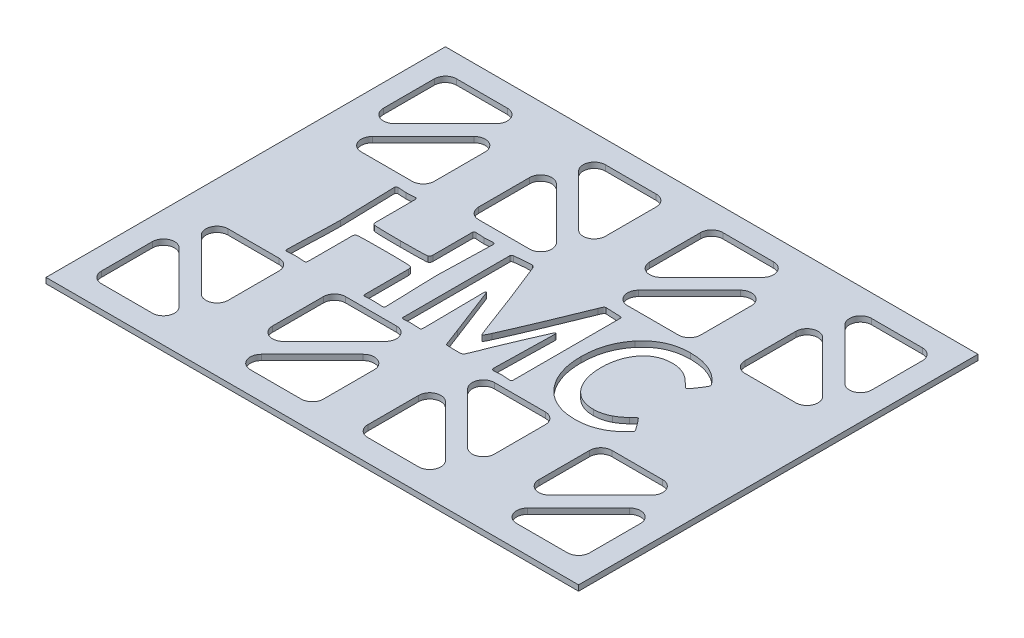
from build123d import *

# Parameters (mm, degrees)
SKETCH2_W           = 609.6
SKETCH2_H           = 457.2
BOSS_EXTRUDE1_DEPTH = 6.35


with BuildPart() as part:
    # Sketch2 → Boss-Extrude1 (new body)
    with BuildSketch(Plane(origin=(0, 0, 0), x_dir=(1, 0, 0), z_dir=(0, 1, 0))):
        with Locations((39.071311338, -112.036262161)):
            Rectangle(SKETCH2_W, SKETCH2_H)
        with BuildLine():
            Line((-240.328688662, 78.463737839), (-240.328688662, 20.224250081))
            ThreePointArc((-240.328688662, 20.224250081), (-232.488768253, 8.490980019), (-218.648432541, 11.24399396))
            Line((-218.648432541, 11.24399396), (-160.408944783, 69.483481718))
            ThreePointArc((-160.408944783, 69.483481718), (-157.655930841, 83.32381743), (-169.389200904, 91.163737839))
            Line((-169.389200904, 91.163737839), (-227.628688662, 91.163737839))
            ThreePointArc((-227.628688662, 91.163737839), (-236.608944783, 87.44399396), (-240.328688662, 78.463737839))
        make_face(mode=Mode.SUBTRACT)
        with BuildLine():
            Line((-218.648432541, -14.15600604), (-160.408944783, 44.083481718))
            ThreePointArc((-160.408944783, 44.083481718), (-146.568609071, 46.83649566), (-138.728688662, 35.103225597))
            Line((-138.728688662, 35.103225597), (-138.728688662, -23.136262161))
            ThreePointArc((-138.728688662, -23.136262161), (-142.448432541, -32.116518282), (-151.428688662, -35.836262161))
            Line((-151.428688662, -35.836262161), (-209.668176419, -35.836262161))
            ThreePointArc((-209.668176419, -35.836262161), (-221.401446482, -27.996341752), (-218.648432541, -14.15600604))
        make_face(mode=Mode.SUBTRACT)
        with BuildLine():
            Line((-75.228688662, -35.836262161), (-16.989200904, -35.836262161))
            ThreePointArc((-16.989200904, -35.836262161), (-5.255930841, -27.996341752), (-8.008944783, -14.15600604))
            Line((-8.008944783, -14.15600604), (-66.248432541, 44.083481718))
            ThreePointArc((-66.248432541, 44.083481718), (-80.088768253, 46.83649566), (-87.928688662, 35.103225597))
            Line((-87.928688662, 35.103225597), (-87.928688662, -23.136262161))
            ThreePointArc((-87.928688662, -23.136262161), (-84.208944783, -32.116518282), (-75.228688662, -35.836262161))
        make_face(mode=Mode.SUBTRACT)
        with BuildLine():
            Line((-57.268176419, 91.163737839), (0.971311338, 91.163737839))
            ThreePointArc((0.971311338, 91.163737839), (9.951567459, 87.44399396), (13.671311338, 78.463737839))
            Line((13.671311338, 78.463737839), (13.671311338, 20.224250081))
            ThreePointArc((13.671311338, 20.224250081), (5.831390929, 8.490980019), (-8.008944783, 11.24399396))
            Line((-8.008944783, 11.24399396), (-66.248432541, 69.483481718))
            ThreePointArc((-66.248432541, 69.483481718), (-69.001446482, 83.32381743), (-57.268176419, 91.163737839))
        make_face(mode=Mode.SUBTRACT)
        with BuildLine():
            Line((64.471311338, 78.463737839), (64.471311338, 20.224250081))
            ThreePointArc((64.471311338, 20.224250081), (72.311231747, 8.490980019), (86.151567459, 11.24399396))
            Line((86.151567459, 11.24399396), (144.391055217, 69.483481718))
            ThreePointArc((144.391055217, 69.483481718), (147.144069159, 83.32381743), (135.410799096, 91.163737839))
            Line((135.410799096, 91.163737839), (77.171311338, 91.163737839))
            ThreePointArc((77.171311338, 91.163737839), (68.191055217, 87.44399396), (64.471311338, 78.463737839))
        make_face(mode=Mode.SUBTRACT)
        with BuildLine():
            Line((86.151567459, -14.15600604), (144.391055217, 44.083481718))
            ThreePointArc((144.391055217, 44.083481718), (158.231390929, 46.83649566), (166.071311338, 35.103225597))
            Line((166.071311338, 35.103225597), (166.071311338, -23.136262161))
            ThreePointArc((166.071311338, -23.136262161), (162.351567459, -32.116518282), (153.371311338, -35.836262161))
            Line((153.371311338, -35.836262161), (95.131823581, -35.836262161))
            ThreePointArc((95.131823581, -35.836262161), (83.398553518, -27.996341752), (86.151567459, -14.15600604))
        make_face(mode=Mode.SUBTRACT)
        with BuildLine():
            Line((229.571311338, -35.836262161), (287.810799096, -35.836262161))
            ThreePointArc((287.810799096, -35.836262161), (299.544069159, -27.996341752), (296.791055217, -14.15600604))
            Line((296.791055217, -14.15600604), (238.551567459, 44.083481718))
            ThreePointArc((238.551567459, 44.083481718), (224.711231747, 46.83649566), (216.871311338, 35.103225597))
            Line((216.871311338, 35.103225597), (216.871311338, -23.136262161))
            ThreePointArc((216.871311338, -23.136262161), (220.591055217, -32.116518282), (229.571311338, -35.836262161))
        make_face(mode=Mode.SUBTRACT)
        with BuildLine():
            Line((247.531823581, 91.163737839), (305.771311338, 91.163737839))
            ThreePointArc((305.771311338, 91.163737839), (314.751567459, 87.44399396), (318.471311338, 78.463737839))
            Line((318.471311338, 78.463737839), (318.471311338, 20.224250081))
            ThreePointArc((318.471311338, 20.224250081), (310.631390929, 8.490980019), (296.791055217, 11.24399396))
            Line((296.791055217, 11.24399396), (238.551567459, 69.483481718))
            ThreePointArc((238.551567459, 69.483481718), (235.798553518, 83.32381743), (247.531823581, 91.163737839))
        make_face(mode=Mode.SUBTRACT)
        with BuildLine():
            Line((318.471311338, -302.536262161), (318.471311338, -244.296774403))
            ThreePointArc((318.471311338, -244.296774403), (310.631390929, -232.56350434), (296.791055217, -235.316518282))
            Line((296.791055217, -235.316518282), (238.551567459, -293.55600604))
            ThreePointArc((238.551567459, -293.55600604), (235.798553518, -307.396341752), (247.531823581, -315.236262161))
            Line((247.531823581, -315.236262161), (305.771311338, -315.236262161))
            ThreePointArc((305.771311338, -315.236262161), (314.751567459, -311.516518282), (318.471311338, -302.536262161))
        make_face(mode=Mode.SUBTRACT)
        with BuildLine():
            Line((296.791055217, -209.916518282), (238.551567459, -268.15600604))
            ThreePointArc((238.551567459, -268.15600604), (224.711231747, -270.909019981), (216.871311338, -259.175749919))
            Line((216.871311338, -259.175749919), (216.871311338, -200.936262161))
            ThreePointArc((216.871311338, -200.936262161), (220.591055217, -191.95600604), (229.571311338, -188.236262161))
            Line((229.571311338, -188.236262161), (287.810799096, -188.236262161))
            ThreePointArc((287.810799096, -188.236262161), (299.544069159, -196.07618257), (296.791055217, -209.916518282))
        make_face(mode=Mode.SUBTRACT)
        with BuildLine():
            Line((153.371311338, -188.236262161), (95.131823581, -188.236262161))
            ThreePointArc((95.131823581, -188.236262161), (83.398553518, -196.07618257), (86.151567459, -209.916518282))
            Line((86.151567459, -209.916518282), (144.391055217, -268.15600604))
            ThreePointArc((144.391055217, -268.15600604), (158.231390929, -270.909019981), (166.071311338, -259.175749919))
            Line((166.071311338, -259.175749919), (166.071311338, -200.936262161))
            ThreePointArc((166.071311338, -200.936262161), (162.351567459, -191.95600604), (153.371311338, -188.236262161))
        make_face(mode=Mode.SUBTRACT)
        with BuildLine():
            Line((135.410799096, -315.236262161), (77.171311338, -315.236262161))
            ThreePointArc((77.171311338, -315.236262161), (68.191055217, -311.516518282), (64.471311338, -302.536262161))
            Line((64.471311338, -302.536262161), (64.471311338, -244.296774403))
            ThreePointArc((64.471311338, -244.296774403), (72.311231747, -232.56350434), (86.151567459, -235.316518282))
            Line((86.151567459, -235.316518282), (144.391055217, -293.55600604))
            ThreePointArc((144.391055217, -293.55600604), (147.144069159, -307.396341752), (135.410799096, -315.236262161))
        make_face(mode=Mode.SUBTRACT)
        with BuildLine():
            Line((13.671311338, -302.536262161), (13.671311338, -244.296774403))
            ThreePointArc((13.671311338, -244.296774403), (5.831390929, -232.56350434), (-8.008944783, -235.316518282))
            Line((-8.008944783, -235.316518282), (-66.248432541, -293.55600604))
            ThreePointArc((-66.248432541, -293.55600604), (-69.001446482, -307.396341752), (-57.268176419, -315.236262161))
            Line((-57.268176419, -315.236262161), (0.971311338, -315.236262161))
            ThreePointArc((0.971311338, -315.236262161), (9.951567459, -311.516518282), (13.671311338, -302.536262161))
        make_face(mode=Mode.SUBTRACT)
        with BuildLine():
            Line((-8.008944783, -209.916518282), (-66.248432541, -268.15600604))
            ThreePointArc((-66.248432541, -268.15600604), (-80.088768253, -270.909019981), (-87.928688662, -259.175749919))
            Line((-87.928688662, -259.175749919), (-87.928688662, -200.936262161))
            ThreePointArc((-87.928688662, -200.936262161), (-84.208944783, -191.95600604), (-75.228688662, -188.236262161))
            Line((-75.228688662, -188.236262161), (-16.989200904, -188.236262161))
            ThreePointArc((-16.989200904, -188.236262161), (-5.255930841, -196.07618257), (-8.008944783, -209.916518282))
        make_face(mode=Mode.SUBTRACT)
        with BuildLine():
            Line((-151.428688662, -188.236262161), (-209.668176419, -188.236262161))
            ThreePointArc((-209.668176419, -188.236262161), (-221.401446482, -196.07618257), (-218.648432541, -209.916518282))
            Line((-218.648432541, -209.916518282), (-160.408944783, -268.15600604))
            ThreePointArc((-160.408944783, -268.15600604), (-146.568609071, -270.909019981), (-138.728688662, -259.175749919))
            Line((-138.728688662, -259.175749919), (-138.728688662, -200.936262161))
            ThreePointArc((-138.728688662, -200.936262161), (-142.448432541, -191.95600604), (-151.428688662, -188.236262161))
        make_face(mode=Mode.SUBTRACT)
        with BuildLine():
            Line((-169.389200904, -315.236262161), (-227.628688662, -315.236262161))
            ThreePointArc((-227.628688662, -315.236262161), (-236.608944783, -311.516518282), (-240.328688662, -302.536262161))
            Line((-240.328688662, -302.536262161), (-240.328688662, -244.296774403))
            ThreePointArc((-240.328688662, -244.296774403), (-232.488768253, -232.56350434), (-218.648432541, -235.316518282))
            Line((-218.648432541, -235.316518282), (-160.408944783, -293.55600604))
            ThreePointArc((-160.408944783, -293.55600604), (-157.655930841, -307.396341752), (-169.389200904, -315.236262161))
        make_face(mode=Mode.SUBTRACT)
        with BuildLine():
            add(Edge.make_bspline(
                [(-42.347338313, -174.953657716), (-42.369691549, -175.267395974), (-42.41146811, -175.853749772), (-42.978228428, -176.595151068), (-43.889123051, -176.994018749), (-44.586756035, -177.026953573), (-44.975294394, -177.045296229)],
                knots=[0, 0, 0, 0, 0.97081256, 1.814377484, 2.782743641, 4, 4, 4, 4], degree=3))
            add(Edge.make_bspline(
                [(-44.975294394, -177.045296229), (-45.261377324, -177.037554922), (-45.896411647, -177.02037111), (-46.951127367, -176.96237211), (-48.20259125, -176.881843445), (-50.017298845, -176.751153708), (-52.05975743, -176.543320116), (-53.627469743, -176.519076044), (-54.280404191, -176.508978662)],
                knots=[0, 0, 0, 0, 0.552547447, 1.226520551, 2.039329384, 2.973851592, 4.739643413, 6, 6, 6, 6], degree=3))
            add(Edge.make_bspline(
                [(-54.280404191, -176.508978662), (-54.593190525, -176.519382085), (-55.290204318, -176.542565098), (-56.445823206, -176.544819155), (-57.810054334, -176.687435931), (-59.322058518, -176.772652883), (-60.831909837, -176.883522238), (-62.199650791, -176.962654158), (-63.352716017, -177.020214951), (-64.050280706, -177.03752968), (-64.363174461, -177.045296229)],
                knots=[0, 0, 0, 0, 0.743793217, 1.657470532, 2.744168461, 4.000356907, 5.256545352, 6.341788949, 7.256206783, 8, 8, 8, 8], degree=3))
            add(Edge.make_bspline(
                [(-64.363174461, -177.045296229), (-64.665482377, -177.028465452), (-65.216499921, -176.997787945), (-65.912708595, -176.548572891), (-66.323858123, -175.815537416), (-66.356235592, -175.245842324), (-66.37436534, -174.926841837)],
                knots=[0, 0, 0, 0, 1.076874829, 1.962822975, 2.859283727, 4, 4, 4, 4], degree=3))
            add(Edge.make_bspline(
                [(-66.37436534, -174.926841837), (-66.37436534, -174.193874495), (-66.37436534, -172.647492175), (-66.37436534, -170.198308617), (-66.37436534, -167.4899049), (-66.37436534, -164.5133424), (-66.37436534, -161.277559743), (-66.37436534, -157.782556927), (-66.37436534, -154.037272581), (-66.37436534, -150.113215711), (-66.37436534, -146.189158842), (-66.37436534, -142.434935869), (-66.37436534, -138.939933054), (-66.37436534, -135.713089022), (-66.37436534, -132.736526522), (-66.37436534, -130.028122806), (-66.37436534, -127.570000621), (-66.37436534, -126.023618301), (-66.37436534, -125.290650959)],
                knots=[0, 0, 0, 0, 0.708806051, 1.495407888, 2.368449487, 3.327930848, 4.373851972, 5.497568882, 6.707725554, 7.995678012, 9.292274446, 10.502431118, 11.626148028, 12.672069152, 13.622906537, 14.504592112, 15.291193949, 16, 16, 16, 16], degree=3))
            add(Edge.make_bspline(
                [(-66.37436534, -125.290650959), (-66.397597751, -124.751990495), (-66.439384018, -123.783145281), (-66.779979338, -122.494519655), (-67.461478708, -121.550685593), (-68.099882041, -121.271061926), (-68.412372097, -121.13418981)],
                knots=[0, 0, 0, 0, 1.301191115, 2.340347711, 3.18762198, 4, 4, 4, 4], degree=3))
            add(Edge.make_bspline(
                [(-68.412372097, -121.13418981), (-68.760480585, -121.076732991), (-69.719608709, -120.918424724), (-71.574508678, -120.782346302), (-74.222046782, -120.697723316), (-77.654284422, -120.580382012), (-81.873692073, -120.507113563), (-86.888502649, -120.464331292), (-92.698459991, -120.39354381), (-96.837176493, -120.40439551), (-99.036105205, -120.410161094)],
                knots=[0, 0, 0, 0, 0.276198848, 0.760998629, 1.454531342, 2.350926455, 3.45007523, 4.759088351, 6.278081219, 8, 8, 8, 8], degree=3))
            add(Edge.make_bspline(
                [(-99.036105205, -120.410161094), (-101.226095222, -120.404403114), (-105.346934714, -120.393568494), (-111.130078184, -120.464201638), (-116.135939996, -120.507565579), (-120.355360697, -120.580230009), (-123.787613205, -120.696706623), (-126.435099099, -120.783871393), (-128.298687066, -120.919601667), (-129.275960372, -121.076767001), (-129.633022434, -121.13418981)],
                knots=[0, 0, 0, 0, 1.716442413, 3.229778959, 4.532949346, 5.640079072, 6.53727042, 7.224419056, 7.716629392, 8, 8, 8, 8], degree=3))
            add(Edge.make_bspline(
                [(-129.633022434, -121.13418981), (-129.936828978, -121.271509316), (-130.560043171, -121.553199972), (-131.212081053, -122.500196167), (-131.517077496, -123.787261031), (-131.564273191, -124.752561903), (-131.590581556, -125.290650959)],
                knots=[0, 0, 0, 0, 0.801092324, 1.643322425, 2.686313823, 4, 4, 4, 4], degree=3))
            add(Edge.make_bspline(
                [(-131.590581556, -125.290650959), (-131.590581556, -126.005741049), (-131.590581556, -127.52530749), (-131.590581556, -129.929797918), (-131.590581556, -132.584569878), (-131.590581556, -135.498561995), (-131.590581556, -138.67177427), (-131.590581556, -142.104206702), (-131.590581556, -145.786920666), (-131.590581556, -149.639468527), (-131.590581556, -153.492016387), (-131.590581556, -157.174730351), (-131.590581556, -160.607162783), (-131.590581556, -163.789313684), (-131.590581556, -166.712244427), (-131.590581556, -169.375955013), (-131.590581556, -171.780445441), (-131.590581556, -173.300011882), (-131.590581556, -174.015101972)],
                knots=[0, 0, 0, 0, 0.704457898, 1.496973032, 2.368739681, 3.319757843, 4.367638965, 5.494771602, 6.701155751, 7.995597138, 9.290038525, 10.496422675, 11.623555311, 12.671436434, 13.631260319, 14.503026968, 15.295542102, 16, 16, 16, 16], degree=3))
            add(Edge.make_bspline(
                [(-131.590581556, -174.015101972), (-131.607568816, -174.456905181), (-131.638143082, -175.252078105), (-132.051005328, -176.296043459), (-132.845159217, -176.961793035), (-133.482724291, -177.016613871), (-133.816299461, -177.045296229)],
                knots=[0, 0, 0, 0, 1.241090689, 2.233758587, 3.075899381, 4, 4, 4, 4], degree=3))
            add(Edge.make_bspline(
                [(-133.816299461, -177.045296229), (-134.129190452, -177.037490912), (-134.826748976, -177.020089755), (-135.979872216, -176.963342332), (-137.347327962, -176.880211706), (-138.859124391, -176.787058226), (-140.366555717, -176.636778333), (-141.744560917, -176.565360498), (-142.906494844, -176.507552268), (-143.612990142, -176.489955923), (-143.92588561, -176.482162783)],
                knots=[0, 0, 0, 0, 0.741742135, 1.653638374, 2.735889305, 3.988613689, 5.242949065, 6.325199997, 7.258257865, 8, 8, 8, 8], degree=3))
            add(Edge.make_bspline(
                [(-143.92588561, -176.482162783), (-144.220908817, -176.489905892), (-144.882743472, -176.507276247), (-145.973134015, -176.565696015), (-147.261865457, -176.636903477), (-149.089779069, -176.827111273), (-151.155459642, -176.963984834), (-152.730319911, -177.021243065), (-153.391890678, -177.045296229)],
                knots=[0, 0, 0, 0, 0.560077054, 1.256438124, 2.072310724, 3.009191766, 4.743614697, 6, 6, 6, 6], degree=3))
            add(Edge.make_bspline(
                [(-153.391890678, -177.045296229), (-153.719877841, -177.027332369), (-154.318739324, -176.994532721), (-155.088984308, -176.563951642), (-155.575277898, -175.839807634), (-155.602699935, -175.265755121), (-155.617608583, -174.953657716)],
                knots=[0, 0, 0, 0, 1.122016328, 2.048654451, 2.939104232, 4, 4, 4, 4], degree=3))
            add(Edge.make_bspline(
                [(-155.617608583, -174.953657716), (-155.60747893, -174.068752961), (-155.586094216, -172.200630229), (-155.57744558, -169.241337548), (-155.471419878, -165.979549192), (-155.416307997, -162.402949766), (-155.254561098, -158.515987623), (-155.146937078, -154.304347171), (-154.932431217, -149.783061237), (-154.773582141, -145.053014269), (-154.531889519, -140.326644686), (-154.399530987, -135.801919562), (-154.209725475, -131.584460798), (-154.130319653, -127.685807841), (-153.994137222, -124.102554861), (-153.966277313, -120.839035773), (-153.887681733, -117.88082995), (-153.896985637, -116.012401248), (-153.901392367, -115.127433054)],
                knots=[0, 0, 0, 0, 0.709689674, 1.498226114, 2.373012936, 3.326628284, 4.366637499, 5.492618124, 6.705085512, 7.996339857, 9.287892618, 10.50008451, 11.626316095, 12.673268466, 13.627072386, 14.50171235, 15.290346528, 16, 16, 16, 16], degree=3))
            add(Edge.make_bspline(
                [(-153.901392367, -115.127433054), (-153.897012101, -114.197774318), (-153.887745428, -112.231034421), (-153.96634409, -109.111908021), (-153.994297546, -105.660731981), (-154.129493008, -101.88074151), (-154.210100537, -97.776602499), (-154.399654481, -93.344533892), (-154.532112284, -88.578560417), (-154.773590445, -83.592850476), (-154.932241596, -78.603654003), (-155.146592003, -73.840937329), (-155.255455942, -69.397011375), (-155.416236113, -65.286477552), (-155.470901941, -61.504346626), (-155.577956905, -58.054824261), (-155.585845133, -54.93465632), (-155.607444244, -52.959269705), (-155.617608583, -52.029671229)],
                knots=[0, 0, 0, 0, 0.706875968, 1.495431726, 2.372335173, 3.331081421, 4.371360051, 5.493587194, 6.704119731, 7.99667198, 9.288956141, 10.499736711, 11.621737419, 12.669009151, 13.627586735, 14.497826846, 15.293091356, 16, 16, 16, 16], degree=3))
            add(Edge.make_bspline(
                [(-155.617608583, -52.029671229), (-155.598741514, -51.73770748), (-155.563071774, -51.185726068), (-155.10207165, -50.465440569), (-154.301064476, -50.112183537), (-153.716619752, -50.06918633), (-153.391890678, -50.045296229)],
                knots=[0, 0, 0, 0, 1.022945257, 1.933961902, 2.852068277, 4, 4, 4, 4], degree=3))
            add(Edge.make_bspline(
                [(-153.391890678, -50.045296229), (-153.096984237, -50.05572844), (-152.426808214, -50.079435679), (-151.31573626, -50.080374878), (-149.996382684, -50.224056179), (-148.52907482, -50.310047173), (-147.054899481, -50.419465999), (-145.70509832, -50.499833144), (-144.560917386, -50.556456046), (-143.863355715, -50.573823567), (-143.550463313, -50.581613797)],
                knots=[0, 0, 0, 0, 0.718465081, 1.632714663, 2.702584002, 3.946050271, 5.211225751, 6.301266533, 7.238030389, 8, 8, 8, 8], degree=3))
            add(Edge.make_bspline(
                [(-143.550463313, -50.581613797), (-143.246507652, -50.573830009), (-142.566814365, -50.556424218), (-141.440571385, -50.498823561), (-140.099640218, -50.419796514), (-138.607748436, -50.307885785), (-137.104594331, -50.223909146), (-135.749282943, -50.081974503), (-134.611575734, -50.078800882), (-133.93243807, -50.055652802), (-133.628588313, -50.045296229)],
                knots=[0, 0, 0, 0, 0.734245204, 1.641889262, 2.723135899, 3.978104294, 5.254608515, 6.358881125, 7.265754796, 8, 8, 8, 8], degree=3))
            add(Edge.make_bspline(
                [(-133.628588313, -50.045296229), (-133.33167129, -50.063450448), (-132.798939853, -50.096022925), (-132.081584432, -50.378721067), (-131.656398726, -50.963813932), (-131.613344701, -51.415459079), (-131.590581556, -51.654248932)],
                knots=[0, 0, 0, 0, 1.21187301, 2.174354449, 3.034760729, 4, 4, 4, 4], degree=3))
            add(Edge.make_bspline(
                [(-131.590581556, -51.654248932), (-131.590581556, -52.333584518), (-131.590581556, -53.763764698), (-131.590581556, -56.034175734), (-131.590581556, -58.545929675), (-131.590581556, -61.307965148), (-131.590581556, -64.3024049), (-131.590581556, -67.538187558), (-131.590581556, -71.015313121), (-131.590581556, -74.662272581), (-131.590581556, -78.30923204), (-131.590581556, -81.786357603), (-131.590581556, -85.022140261), (-131.590581556, -88.016580013), (-131.590581556, -90.778615486), (-131.590581556, -93.299308054), (-131.590581556, -95.578657716), (-131.590581556, -97.017776522), (-131.590581556, -97.697112108)],
                knots=[0, 0, 0, 0, 0.708211998, 1.490972627, 2.366919045, 3.326732673, 4.370413512, 5.488642982, 6.700058241, 7.995340711, 9.29062318, 10.502038439, 11.620267909, 12.663948748, 13.623762376, 14.499708794, 15.291788002, 16, 16, 16, 16], degree=3))
            add(Edge.make_bspline(
                [(-131.590581556, -97.697112108), (-131.576709688, -98.075898771), (-131.551176029, -98.773123515), (-131.203778367, -99.702058875), (-130.590922257, -100.394505112), (-130.048407536, -100.613666438), (-129.767101826, -100.727306364)],
                knots=[0, 0, 0, 0, 1.18557836, 2.182269466, 3.057467089, 4, 4, 4, 4], degree=3))
            add(Edge.make_bspline(
                [(-129.767101826, -100.727306364), (-129.446173901, -100.795753123), (-128.536597997, -100.989745348), (-126.736858015, -101.091076217), (-124.129033478, -101.237240816), (-120.694182497, -101.321151368), (-116.431554255, -101.449330298), (-111.344455329, -101.4726973), (-105.436364633, -101.550027287), (-101.22611097, -101.538125278), (-98.982473448, -101.531782716)],
                knots=[0, 0, 0, 0, 0.255301972, 0.723578425, 1.399725174, 2.291212045, 3.39841577, 4.721144201, 6.252702927, 8, 8, 8, 8], degree=3))
            add(Edge.make_bspline(
                [(-98.982473448, -101.531782716), (-96.783530091, -101.538091117), (-92.653724438, -101.549938839), (-86.852883036, -101.472808977), (-81.837341187, -101.448720172), (-77.610347946, -101.321239314), (-74.175839236, -101.235736312), (-71.540518327, -101.092231132), (-69.689144864, -100.983415919), (-68.733367744, -100.795639159), (-68.385556218, -100.727306364)],
                knots=[0, 0, 0, 0, 1.723074995, 3.236083746, 4.545975828, 5.653020866, 6.55001788, 7.237338963, 7.722464272, 8, 8, 8, 8], degree=3))
            add(Edge.make_bspline(
                [(-68.385556218, -100.727306364), (-68.070606375, -100.611993594), (-67.431020763, -100.37782174), (-66.805273976, -99.457927533), (-66.43268613, -98.281781662), (-66.395182018, -97.38846929), (-66.37436534, -96.892635756)],
                knots=[0, 0, 0, 0, 0.843206921, 1.712345715, 2.730236204, 4, 4, 4, 4], degree=3))
            add(Edge.make_bspline(
                [(-66.37436534, -96.892635756), (-66.37436534, -96.231177423), (-66.37436534, -94.827813121), (-66.37436534, -92.602095216), (-66.37436534, -90.135034405), (-66.37436534, -87.435569315), (-66.37436534, -84.503699945), (-66.37436534, -81.339426297), (-66.37436534, -77.933809743), (-66.37436534, -74.367297918), (-66.37436534, -70.800786094), (-66.37436534, -67.386230914), (-66.37436534, -64.213018639), (-66.37436534, -61.272210644), (-66.37436534, -58.572745554), (-66.37436534, -56.105684743), (-66.37436534, -53.879966837), (-66.37436534, -52.476602536), (-66.37436534, -51.815144202)],
                knots=[0, 0, 0, 0, 0.704342653, 1.494348602, 2.370017847, 3.331350387, 4.368828079, 5.491969066, 6.700773349, 7.995240928, 9.289708507, 10.49851279, 11.631171921, 12.668649613, 13.629982153, 14.505651398, 15.295657347, 16, 16, 16, 16], degree=3))
            add(Edge.make_bspline(
                [(-66.37436534, -51.815144202), (-66.352484071, -51.550415112), (-66.311836302, -51.058640763), (-65.899155937, -50.410507641), (-65.163258131, -50.08513521), (-64.616215952, -50.059607262), (-64.309542705, -50.045296229)],
                knots=[0, 0, 0, 0, 1.017086362, 1.889391842, 2.816787659, 4, 4, 4, 4], degree=3))
            add(Edge.make_bspline(
                [(-64.309542705, -50.045296229), (-63.611926439, -50.055288453), (-61.954968017, -50.0790217), (-59.341185683, -50.327995653), (-56.722484511, -50.501408132), (-55.058219546, -50.557929825), (-54.360851826, -50.581613797)],
                knots=[0, 0, 0, 0, 0.839869077, 1.994833275, 3.159786106, 4, 4, 4, 4], degree=3))
            add(Edge.make_bspline(
                [(-54.360851826, -50.581613797), (-54.056891302, -50.573935482), (-53.386112929, -50.556991019), (-52.277784701, -50.498509787), (-50.972521491, -50.420745888), (-49.525428535, -50.307657874), (-48.075805369, -50.224309679), (-46.765373157, -50.081454767), (-45.654360879, -50.078607126), (-44.984164507, -50.055687312), (-44.680319732, -50.045296229)],
                knots=[0, 0, 0, 0, 0.752479509, 1.660567539, 2.74658428, 3.98858287, 5.252648408, 6.340241208, 7.247520491, 8, 8, 8, 8], degree=3))
            add(Edge.make_bspline(
                [(-44.680319732, -50.045296229), (-44.33749799, -50.068350427), (-43.726638706, -50.109429708), (-42.895691805, -50.463073519), (-42.396328471, -51.176862047), (-42.36418458, -51.736415365), (-42.347338313, -52.029671229)],
                knots=[0, 0, 0, 0, 1.178462696, 2.09985188, 3.004152848, 4, 4, 4, 4], degree=3))
            add(Edge.make_bspline(
                [(-42.347338313, -52.029671229), (-42.343024246, -52.959328978), (-42.333856146, -54.935004485), (-42.411684518, -58.054144436), (-42.440694249, -61.505303476), (-42.575913081, -65.285288502), (-42.655445174, -69.398395463), (-42.845666588, -73.839384557), (-42.97803661, -78.605360318), (-43.219550159, -83.591069267), (-43.378155831, -88.580267207), (-43.592640406, -93.342979413), (-43.700842793, -97.777988681), (-43.862558305, -101.879551448), (-43.91718425, -105.661689371), (-44.023334901, -109.111229298), (-44.032003749, -112.231384057), (-44.053427085, -114.197834061), (-44.063554529, -115.127433054)],
                knots=[0, 0, 0, 0, 0.706875989, 1.502227654, 2.372335066, 3.331081343, 4.378154583, 5.50038176, 6.710914333, 8.003466621, 9.295750821, 10.506531428, 11.628532169, 12.669010652, 13.627588265, 14.504623435, 15.293091335, 16, 16, 16, 16], degree=3))
            add(Edge.make_bspline(
                [(-44.063554529, -115.127433054), (-44.053426158, -116.012337852), (-44.032044149, -117.880460673), (-44.023372656, -120.839752591), (-43.917448027, -124.101544324), (-43.861765702, -127.68706201), (-43.701125094, -131.58300169), (-43.592766058, -135.803555455), (-43.378413248, -140.324846639), (-43.219512432, -145.054891889), (-42.97786008, -149.78126263), (-42.845401366, -154.305985086), (-42.656323372, -158.514525755), (-42.57570741, -162.404206334), (-42.44013462, -165.97853734), (-42.412211446, -169.242054667), (-42.333630175, -172.200260889), (-42.342932386, -174.068689544), (-42.347338313, -174.953657716)],
                knots=[0, 0, 0, 0, 0.709689742, 1.498226256, 2.373013161, 3.326628601, 4.373801903, 5.499782635, 6.712250138, 8.003504606, 9.29505749, 10.507249497, 11.63348119, 12.67326815, 13.62707216, 14.501712208, 15.290346461, 16, 16, 16, 16], degree=3))
        make_face(mode=Mode.SUBTRACT)
        with BuildLine():
            add(Edge.make_bspline(
                [(103.531040066, -174.792762445), (103.514225689, -175.129569324), (103.483893334, -175.737153321), (103.048077213, -176.527008821), (102.294604295, -177.001121906), (101.705835625, -177.029739281), (101.385769795, -177.045296229)],
                knots=[0, 0, 0, 0, 1.128070766, 2.034987371, 2.931781821, 4, 4, 4, 4], degree=3))
            add(Edge.make_bspline(
                [(101.385769795, -177.045296229), (101.099693627, -177.037421826), (100.455750232, -177.019696933), (99.391991492, -176.963640516), (98.122819349, -176.880419533), (96.307758802, -176.754548979), (94.274549373, -176.543176992), (92.724666002, -176.519017422), (92.080659998, -176.508978662)],
                knots=[0, 0, 0, 0, 0.552548226, 1.243758903, 2.056568883, 3.008304815, 4.756893779, 6, 6, 6, 6], degree=3))
            add(Edge.make_bspline(
                [(92.080659998, -176.508978662), (91.785754046, -176.51935311), (91.133438706, -176.542300805), (90.049206184, -176.545408465), (88.774475539, -176.68652486), (86.940732879, -176.799394121), (84.887249528, -176.96890758), (83.321044616, -177.022824786), (82.668286687, -177.045296229)],
                knots=[0, 0, 0, 0, 0.563333031, 1.246060904, 2.067917339, 3.00885354, 4.753359441, 6, 6, 6, 6], degree=3))
            add(Edge.make_bspline(
                [(82.668286687, -177.045296229), (82.344468496, -177.014705019), (81.717440587, -176.955469487), (80.942949001, -176.311254771), (80.544822534, -175.294416652), (80.513753365, -174.528347675), (80.496200539, -174.095549608)],
                knots=[0, 0, 0, 0, 0.92387763, 1.788957734, 2.750850318, 4, 4, 4, 4], degree=3))
            add(Edge.make_bspline(
                [(80.496200539, -174.095549608), (80.491881303, -173.085448523), (80.482783539, -170.957835968), (80.55943767, -167.588347099), (80.596606113, -163.860562378), (80.693338079, -159.776053969), (80.752045725, -155.332681491), (80.910013635, -150.542563129), (81.028123331, -145.393259521), (81.197368122, -140.012676376), (81.343635962, -134.622271), (81.525702289, -129.47468786), (81.613872225, -124.673670782), (81.730985711, -120.240571657), (81.815002762, -116.146648547), (81.854459109, -112.418920428), (81.930762349, -109.040482198), (81.921730185, -106.912871225), (81.917442093, -105.902770891)],
                knots=[0, 0, 0, 0, 0.710791345, 1.497165594, 2.371592352, 3.334176241, 4.372228945, 5.498611931, 6.706737647, 7.996778562, 9.286819476, 10.501412441, 11.621348734, 12.665823189, 13.622118105, 14.502834406, 15.289208655, 16, 16, 16, 16], degree=3))
            add(Edge.make_bspline(
                [(81.917442093, -105.902770891), (81.903124942, -105.652178757), (81.878904851, -105.228256117), (81.806814992, -104.673937812), (81.563409152, -104.297076508), (81.324808283, -104.238878713), (81.220229255, -104.213370554)],
                knots=[0, 0, 0, 0, 1.513432116, 2.560248502, 3.368955304, 4, 4, 4, 4], degree=3))
            add(Edge.make_bspline(
                [(81.220229255, -104.213370554), (80.958995494, -104.266221101), (80.376503078, -104.384065912), (80.090696392, -104.913540186), (79.933067093, -105.205558054)],
                knots=[0, 0, 0, 0, 0.896951629, 2, 2, 2, 2], degree=3))
            add(Edge.make_bspline(
                [(79.933067093, -105.205558054), (79.715793594, -105.651213127), (79.240764926, -106.625556236), (78.533351534, -108.237443748), (77.69035866, -110.091378722), (76.763844084, -112.206260869), (75.701010749, -114.56366852), (74.601136497, -117.201920348), (73.307457448, -120.054253944), (72.029510828, -123.20964155), (70.549901122, -126.576394572), (69.052507739, -130.235162277), (67.355032454, -134.106401298), (65.674263113, -138.280029319), (63.795518965, -142.66742736), (61.884560856, -147.336430616), (59.835544492, -152.248096487), (58.443801132, -155.610134407), (57.729519795, -157.335625621)],
                knots=[0, 0, 0, 0, 0.419936897, 0.918115032, 1.490864634, 2.145101273, 2.873910029, 3.681206217, 4.566086307, 5.526523327, 6.564475569, 7.681006029, 8.875049204, 10.144764203, 11.491944577, 12.917749911, 14.418103669, 16, 16, 16, 16], degree=3))
            add(Edge.make_bspline(
                [(57.729519795, -157.335625621), (57.20993495, -158.777692217), (56.104020585, -161.847069964), (54.177514297, -166.662866104), (51.98813877, -172.007475494), (50.371678476, -175.716640833), (49.523861012, -177.662061432)],
                knots=[0, 0, 0, 0, 0.838892904, 1.785548059, 2.838541821, 4, 4, 4, 4], degree=3))
            add(Edge.make_bspline(
                [(49.523861012, -177.662061432), (49.430681117, -177.759160226), (49.208283958, -177.990910822), (48.662465716, -178.16670162), (47.968995742, -178.357189396), (47.070679221, -178.518104839), (45.96776387, -178.610156419), (44.662113367, -178.690370271), (43.151007026, -178.742520786), (42.078030116, -178.754907687), (41.505913376, -178.761512445)],
                knots=[0, 0, 0, 0, 0.388302156, 0.926780362, 1.630083683, 2.506176111, 3.582181847, 4.864459833, 6.328114053, 8, 8, 8, 8], degree=3))
            add(Edge.make_bspline(
                [(41.505913376, -178.761512445), (40.683492829, -178.767254922), (39.136763934, -178.778054816), (36.96502277, -178.707629596), (35.078523928, -178.663152248), (33.485954596, -178.593405854), (32.182610695, -178.47046221), (31.174485495, -178.394213923), (30.453795074, -178.239936004), (30.090210528, -178.094328017), (29.948269795, -178.037483729)],
                knots=[0, 0, 0, 0, 1.69868681, 3.194725595, 4.487732124, 5.596955283, 6.48629867, 7.191806625, 7.684487251, 8, 8, 8, 8], degree=3))
            add(Edge.make_bspline(
                [(29.948269795, -178.037483729), (29.706016432, -177.394244663), (29.201597432, -176.054894813), (28.425636954, -173.937998672), (27.538859615, -171.657179903), (26.594789184, -169.183245019), (25.616815909, -166.516298372), (24.50009922, -163.687211714), (23.358318298, -160.649275598), (22.557483255, -158.568599271), (22.144849187, -157.496520891)],
                knots=[0, 0, 0, 0, 0.750736115, 1.563179782, 2.462489513, 3.423488316, 4.455322605, 5.564916858, 6.745311822, 8, 8, 8, 8], degree=3))
            add(Edge.make_bspline(
                [(22.144849187, -157.496520891), (21.556870088, -155.913643818), (20.309871035, -152.556643182), (18.294750771, -147.260857044), (16.070168478, -141.40220627), (13.608313104, -135.012472143), (10.907954102, -128.07442679), (8.031885666, -120.572625693), (4.884311872, -112.535244033), (2.720702399, -106.993480798), (1.603886349, -104.132922918)],
                knots=[0, 0, 0, 0, 0.708716434, 1.503061457, 2.378208417, 3.339006028, 4.377112648, 5.503026776, 6.711107615, 8, 8, 8, 8], degree=3))
            add(Edge.make_bspline(
                [(1.603886349, -104.132922918), (1.489344871, -103.91882802), (1.227380378, -103.429177789), (0.799091013, -103.073012208), (0.558067093, -102.872576635)],
                knots=[0, 0, 0, 0, 0.874480946, 2, 2, 2, 2], degree=3))
            add(Edge.make_bspline(
                [(0.558067093, -102.872576635), (0.362059148, -103.112597444), (-0.103474311, -103.682664733), (-0.12606603, -104.426373555), (-0.139145745, -104.856951635)],
                knots=[0, 0, 0, 0, 0.842078872, 2, 2, 2, 2], degree=3))
            add(Edge.make_bspline(
                [(-0.139145745, -104.856951635), (-0.141346001, -105.884903177), (-0.146014445, -108.065982834), (-0.106389696, -111.516186868), (-0.094582263, -115.333195344), (-0.016405723, -119.50712518), (-0.02160266, -124.048560352), (0.083712513, -128.955383788), (0.15909692, -134.229218), (0.22753166, -139.744708892), (0.347173392, -145.250379573), (0.427112446, -150.515302689), (0.475045641, -155.413851489), (0.526684903, -159.954692587), (0.591400184, -164.128832332), (0.606347523, -167.945810352), (0.645259951, -171.396021295), (0.640675431, -173.577100138), (0.638514728, -174.605051297)],
                knots=[0, 0, 0, 0, 0.707366902, 1.500871876, 2.374337883, 3.333975319, 4.373515313, 5.499302584, 6.711193339, 8.003038614, 9.29498639, 10.500726846, 11.626430095, 12.666024681, 13.625662117, 14.499128124, 15.292633098, 16, 16, 16, 16], degree=3))
            add(Edge.make_bspline(
                [(0.638514728, -174.605051297), (0.622474997, -175.0475078), (0.594333508, -175.823791736), (0.190982483, -176.836573758), (-0.558432132, -177.498344909), (-1.181400279, -177.553045514), (-1.506755542, -177.581613797)],
                knots=[0, 0, 0, 0, 1.273061421, 2.233569006, 3.077452634, 4, 4, 4, 4], degree=3))
            add(Edge.make_bspline(
                [(-1.506755542, -177.581613797), (-2.114735161, -177.557543114), (-3.600299441, -177.498727743), (-5.959768203, -177.326901523), (-8.32297218, -177.081452325), (-9.819266037, -177.055854554), (-10.436443042, -177.045296229)],
                knots=[0, 0, 0, 0, 0.81596766, 1.993771456, 3.172490003, 4, 4, 4, 4], degree=3))
            add(Edge.make_bspline(
                [(-10.436443042, -177.045296229), (-11.071492668, -177.055767874), (-12.603480229, -177.081029567), (-15.011592056, -177.325105678), (-17.433342748, -177.50215045), (-18.963713432, -177.558084703), (-19.607473448, -177.581613797)],
                knots=[0, 0, 0, 0, 0.829145214, 2.000221877, 3.158780805, 4, 4, 4, 4], degree=3))
            add(Edge.make_bspline(
                [(-19.607473448, -177.581613797), (-19.923675065, -177.567346405), (-20.488786121, -177.541847924), (-21.233452253, -177.218576037), (-21.697220055, -176.608649705), (-21.733457658, -176.123565072), (-21.752743718, -175.865397581)],
                knots=[0, 0, 0, 0, 1.210561661, 2.163498672, 3.022593359, 4, 4, 4, 4], degree=3))
            add(Edge.make_bspline(
                [(-21.752743718, -175.865397581), (-21.752743718, -174.980473594), (-21.752743718, -173.103362108), (-21.752743718, -170.135738234), (-21.752743718, -166.855262445), (-21.752743718, -163.270873369), (-21.752743718, -159.373632378), (-21.752743718, -155.163539472), (-21.752743718, -150.640594653), (-21.752743718, -145.912061432), (-21.752743718, -141.183528211), (-21.752743718, -136.660583391), (-21.752743718, -132.44155186), (-21.752743718, -128.535372243), (-21.752743718, -124.94204454), (-21.752743718, -121.661568752), (-21.752743718, -118.693944878), (-21.752743718, -116.816833391), (-21.752743718, -115.931909405)],
                knots=[0, 0, 0, 0, 0.708724832, 1.503355705, 2.376733781, 3.336017897, 4.374049217, 5.497986577, 6.707829978, 7.996420582, 9.285011186, 10.494854586, 11.618791946, 12.663982103, 13.623266219, 14.496644295, 15.291275168, 16, 16, 16, 16], degree=3))
            add(Edge.make_bspline(
                [(-21.752743718, -115.931909405), (-21.752743718, -115.011230914), (-21.752743718, -113.071549045), (-21.752743718, -109.996661657), (-21.752743718, -106.599983729), (-21.752743718, -102.872576635), (-21.752743718, -98.814440373), (-21.752743718, -94.434513572), (-21.752743718, -89.723857603), (-21.752743718, -84.798674608), (-21.752743718, -79.873491612), (-21.752743718, -75.162835644), (-21.752743718, -70.782908842), (-21.752743718, -66.724772581), (-21.752743718, -62.997365486), (-21.752743718, -59.591748932), (-21.752743718, -56.507922918), (-21.752743718, -54.559302423), (-21.752743718, -53.638623932)],
                knots=[0, 0, 0, 0, 0.709427464, 1.494619027, 2.369349978, 3.326732673, 4.366767111, 5.496340938, 6.701678864, 7.996556177, 9.291433491, 10.496771416, 11.626345243, 12.666379681, 13.623762376, 14.498493328, 15.290572536, 16, 16, 16, 16], degree=3))
            add(Edge.make_bspline(
                [(-21.752743718, -53.638623932), (-21.732178765, -53.380461571), (-21.691945397, -52.875391572), (-21.203507256, -52.237180751), (-20.441294145, -51.820601659), (-19.837161262, -51.731025405), (-19.500209934, -51.68106481)],
                knots=[0, 0, 0, 0, 0.92109772, 1.802039699, 2.774101421, 4, 4, 4, 4], degree=3))
            add(Edge.make_bspline(
                [(-19.500209934, -51.68106481), (-18.427452132, -51.557172337), (-16.344701414, -51.316636088), (-13.327403406, -50.947473558), (-10.507488471, -50.703187455), (-7.901125608, -50.433807674), (-5.493387263, -50.294448405), (-3.295732285, -50.148090911), (-1.301842444, -50.063428555), (-0.040887095, -50.051135455), (0.558067093, -50.045296229)],
                knots=[0, 0, 0, 0, 1.287186291, 2.499061919, 3.622824296, 4.660729249, 5.621743766, 6.497018098, 7.286083123, 8, 8, 8, 8], degree=3))
            add(Edge.make_bspline(
                [(0.558067093, -50.045296229), (0.739676696, -50.081609766), (1.161735027, -50.166001946), (1.816247002, -50.54915608), (2.531015994, -51.190463268), (3.020666083, -51.712309194), (3.293286687, -52.002855351)],
                knots=[0, 0, 0, 0, 0.644578438, 1.497991813, 2.606966489, 4, 4, 4, 4], degree=3))
            add(Edge.make_bspline(
                [(3.293286687, -52.002855351), (4.895370476, -56.015474801), (8.055232601, -63.929745152), (12.692853422, -75.648938619), (17.169458355, -87.033927819), (21.474443495, -98.094535544), (25.560357713, -108.839834712), (29.508532317, -119.250971487), (33.298352119, -129.327282196), (35.727085202, -135.952777538), (36.920398174, -139.208091837)],
                knots=[0, 0, 0, 0, 1.109420449, 2.188159997, 3.23622524, 4.250652117, 5.235745292, 6.188054551, 7.109734197, 8, 8, 8, 8], degree=3))
            add(Edge.make_bspline(
                [(36.920398174, -139.208091837), (37.174368932, -139.916286045), (37.649142389, -141.240185749), (38.38594982, -143.05155776), (38.996135324, -144.59660768), (39.538923343, -145.851195693), (39.966717, -146.856643643), (40.374846613, -147.526053358), (40.584454113, -148.031520018), (40.812974659, -148.151438325), (40.889148174, -148.191411094)],
                knots=[0, 0, 0, 0, 1.827398573, 3.41614264, 4.750850743, 5.860006045, 6.744200085, 7.385429686, 7.795143229, 8, 8, 8, 8], degree=3))
            add(Edge.make_bspline(
                [(40.889148174, -148.191411094), (40.982389558, -148.161736822), (41.234792458, -148.081409052), (41.546208077, -147.683924051), (41.974196183, -147.139516343), (42.420838524, -146.332230245), (43.006505089, -145.341390714), (43.606465847, -144.10556547), (44.274843553, -142.652745082), (44.742514869, -141.613001713), (44.991977566, -141.058387445)],
                knots=[0, 0, 0, 0, 0.27736226, 0.750815097, 1.394626081, 2.295593491, 3.391207711, 4.715644425, 6.248076863, 8, 8, 8, 8], degree=3))
            add(Edge.make_bspline(
                [(44.991977566, -141.058387445), (45.547013435, -139.816292576), (46.688188449, -137.262497934), (48.430176124, -133.32007468), (50.253175549, -129.163386733), (52.161839303, -124.785496212), (54.140672707, -120.192418998), (56.176613532, -115.36601047), (58.332276262, -110.34550436), (60.513516879, -105.074619712), (62.835448977, -99.618294016), (65.191911205, -93.919188061), (67.621380852, -88.006328933), (70.15521645, -81.879829035), (72.748504394, -75.530172165), (75.431224256, -68.960744685), (78.193105226, -62.176259696), (80.058598355, -57.580716633), (81.005702228, -55.247576635)],
                knots=[0, 0, 0, 0, 0.701671456, 1.442663398, 2.222982774, 3.042635534, 3.905859746, 4.802382248, 5.744303701, 6.723790156, 7.744421426, 8.802635453, 9.904477547, 11.041426237, 12.222009824, 13.441965961, 14.701295701, 16, 16, 16, 16], degree=3))
            add(Edge.make_bspline(
                [(81.005702228, -55.247576635), (81.272663944, -54.4775837), (81.743480426, -53.119616084), (82.595651513, -51.461107777), (83.529400909, -50.306623637), (84.314649621, -50.123934974), (84.652661687, -50.045296229)],
                knots=[0, 0, 0, 0, 1.46292682, 2.580033088, 3.388772063, 4, 4, 4, 4], degree=3))
            add(Edge.make_bspline(
                [(84.652661687, -50.045296229), (85.18003222, -50.053741219), (86.342195655, -50.072351393), (88.265536958, -50.115048123), (90.534183565, -50.271795216), (93.046214713, -50.417241725), (95.565634195, -50.583181541), (97.845335146, -50.690852019), (99.776600575, -50.743845653), (100.938821025, -50.761371848), (101.466217431, -50.769324945)],
                knots=[0, 0, 0, 0, 0.752083313, 1.657361707, 2.742588663, 3.99397119, 5.245353717, 6.342638293, 7.247916687, 8, 8, 8, 8], degree=3))
            add(Edge.make_bspline(
                [(101.466217431, -50.769324945), (101.775847622, -50.787181893), (102.340474544, -50.819744975), (103.087253538, -51.261522571), (103.466819725, -52.044461503), (103.508389182, -52.625051813), (103.531040066, -52.941411094)],
                knots=[0, 0, 0, 0, 1.077694319, 1.965232209, 2.891270377, 4, 4, 4, 4], degree=3))
            add(Edge.make_bspline(
                [(103.531040066, -52.941411094), (103.531040066, -53.862089585), (103.531040066, -55.810710081), (103.531040066, -58.894536094), (103.531040066, -62.300152648), (103.531040066, -66.036498369), (103.531040066, -70.09463463), (103.531040066, -74.483500058), (103.531040066, -79.194156027), (103.531040066, -84.128277648), (103.531040066, -89.06239927), (103.531040066, -93.773055238), (103.531040066, -98.161920666), (103.531040066, -102.220056927), (103.531040066, -105.956402648), (103.531040066, -109.362019202), (103.531040066, -112.445845216), (103.531040066, -114.394465711), (103.531040066, -115.315144202)],
                knots=[0, 0, 0, 0, 0.708512468, 1.499570077, 2.373172829, 3.329320722, 4.374892519, 5.496130696, 6.706792777, 8, 9.293207223, 10.503869304, 11.625107481, 12.670679278, 13.626827171, 14.500429923, 15.291487532, 16, 16, 16, 16], degree=3))
            add(Edge.make_bspline(
                [(103.531040066, -115.315144202), (103.531040066, -116.191129563), (103.531040066, -118.050363797), (103.531040066, -121.000110418), (103.531040066, -124.262708954), (103.531040066, -127.829220779), (103.531040066, -131.708584518), (103.531040066, -135.900800171), (103.531040066, -140.405867738), (103.531040066, -145.107585081), (103.531040066, -149.809302423), (103.531040066, -154.305431364), (103.531040066, -158.488708391), (103.531040066, -162.350194878), (103.531040066, -165.89882945), (103.531040066, -169.134612108), (103.531040066, -172.066481477), (103.531040066, -173.916777085), (103.531040066, -174.792762445)],
                knots=[0, 0, 0, 0, 0.706943192, 1.500450857, 2.380522994, 3.339945897, 4.378719567, 5.511271416, 6.723174031, 8.014427412, 9.305680794, 10.517583408, 11.642921551, 12.681695221, 13.633904418, 14.506762849, 15.293056808, 16, 16, 16, 16], degree=3))
        make_face(mode=Mode.SUBTRACT)
        with BuildLine():
            add(Edge.make_bspline(
                [(223.666175201, -155.780304675), (223.641304224, -155.980216514), (223.585589225, -156.428051276), (223.201897922, -157.124821305), (222.65512656, -157.930699239), (222.179969843, -158.484401631), (221.923143106, -158.783683054)],
                knots=[0, 0, 0, 0, 0.679757933, 1.5227674, 2.661032156, 4, 4, 4, 4], degree=3))
            add(Edge.make_bspline(
                [(221.923143106, -158.783683054), (220.436606728, -160.381897765), (217.518544114, -163.519184326), (212.640153428, -167.57690254), (207.525511641, -171.039123332), (202.135196555, -173.879236116), (196.461115592, -176.060051347), (190.53435775, -177.609158737), (184.341311979, -178.580841495), (180.120805828, -178.700558208), (177.971918444, -178.761512445)],
                knots=[0, 0, 0, 0, 1.050233005, 2.061601529, 3.047766163, 4.020127019, 4.989013374, 5.968390316, 6.965597902, 8, 8, 8, 8], degree=3))
            add(Edge.make_bspline(
                [(177.971918444, -178.761512445), (175.752133568, -178.697258539), (171.400657623, -178.571300689), (165.040221888, -177.655146001), (159.022521064, -176.099516157), (153.35915244, -173.911991157), (148.017927297, -171.136132003), (143.044888178, -167.699096015), (138.380500494, -163.668272755), (135.64812867, -160.552154896), (134.262036687, -158.971394202)],
                knots=[0, 0, 0, 0, 1.072462952, 2.102364418, 3.097635614, 4.069844714, 5.030052859, 5.999311743, 6.985080314, 8, 8, 8, 8], degree=3))
            add(Edge.make_bspline(
                [(134.262036687, -158.971394202), (133.02946839, -157.413898565), (130.573317771, -154.310262132), (127.507894645, -149.209663638), (124.860813311, -143.870332722), (122.719444822, -138.225864519), (121.00919019, -132.311636164), (119.860308989, -126.085769974), (119.106841962, -119.588441827), (119.020772534, -115.156432822), (118.976986012, -112.901715148)],
                knots=[0, 0, 0, 0, 0.961228712, 1.915449636, 2.875897892, 3.844857895, 4.835704658, 5.85387429, 6.908190944, 8, 8, 8, 8], degree=3))
            add(Edge.make_bspline(
                [(118.976986012, -112.901715148), (119.021520806, -110.64713482), (119.109061084, -106.21539579), (119.852100537, -99.714436112), (121.041953467, -93.483103932), (122.771196365, -87.549184972), (124.945672055, -81.881389022), (127.604801355, -76.495210477), (130.776327528, -71.398045204), (133.240598835, -68.25003674), (134.476563714, -66.671140824)],
                knots=[0, 0, 0, 0, 1.086701115, 2.136085232, 3.150306645, 4.141851665, 5.111847018, 6.073574013, 7.033793537, 8, 8, 8, 8], degree=3))
            add(Edge.make_bspline(
                [(134.476563714, -66.671140824), (135.872358149, -65.073452579), (138.61933065, -61.929145962), (143.281031687, -57.846187004), (148.233942661, -54.339633973), (153.560471, -51.522009935), (159.203883883, -49.293470949), (165.195625469, -47.759811267), (171.504708835, -46.792703028), (175.823053388, -46.673606776), (178.025550201, -46.612863797)],
                knots=[0, 0, 0, 0, 1.024564223, 2.016378399, 2.9873516, 3.951929547, 4.922017841, 5.91345546, 6.935794112, 8, 8, 8, 8], degree=3))
            add(Edge.make_bspline(
                [(178.025550201, -46.612863797), (180.254111395, -46.668388869), (184.594415788, -46.77652847), (190.902024557, -47.647960975), (196.823450974, -49.071418273), (202.374498288, -51.034315291), (207.518965593, -53.650146951), (212.284722733, -56.797055899), (216.694222516, -60.507864899), (219.223918041, -63.408896976), (220.501901552, -64.874476972)],
                knots=[0, 0, 0, 0, 1.11720067, 2.175839276, 3.185817602, 4.166956791, 5.121145464, 6.072191569, 7.026085407, 8, 8, 8, 8], degree=3))
            add(Edge.make_bspline(
                [(220.501901552, -64.874476972), (220.723528864, -65.164722428), (221.13244294, -65.700240599), (221.601696169, -66.514617714), (221.897010664, -67.267825162), (221.933312831, -67.759612533), (221.949958985, -67.985118864)],
                knots=[0, 0, 0, 0, 1.253613079, 2.312982233, 3.226427496, 4, 4, 4, 4], degree=3))
            add(Edge.make_bspline(
                [(221.949958985, -67.985118864), (221.927835388, -68.138218544), (221.871659217, -68.526968797), (221.609278965, -69.181667091), (221.19358622, -70.010980192), (220.656686077, -71.049904948), (219.930145637, -72.254448106), (219.073786103, -73.670628707), (218.014906608, -75.233088707), (216.890667469, -76.94469655), (215.732271794, -78.613151436), (214.650770763, -80.117279585), (213.725439881, -81.412898429), (212.897206712, -82.454449233), (212.194046679, -83.267683281), (211.640156703, -83.860361637), (211.20162856, -84.25986513), (210.904815454, -84.339891783), (210.794553579, -84.369620554)],
                knots=[0, 0, 0, 0, 0.369789192, 0.938967621, 1.676682302, 2.596552482, 3.739134059, 5.047062651, 6.562081115, 8.261265228, 9.954768697, 11.428953496, 12.70149487, 13.768697705, 14.61909954, 15.270603333, 15.729039445, 16, 16, 16, 16], degree=3))
            add(Edge.make_bspline(
                [(210.794553579, -84.369620554), (210.528655871, -84.293421958), (209.79116702, -84.082078978), (208.668537492, -83.08971089), (207.067550379, -81.7249029), (205.922400873, -80.556515899), (205.270482633, -79.891368864)],
                knots=[0, 0, 0, 0, 0.458405121, 1.271423764, 2.44665818, 4, 4, 4, 4], degree=3))
            add(Edge.make_bspline(
                [(205.270482633, -79.891368864), (204.404822938, -79.022288997), (202.743137587, -77.354038422), (200.187736971, -75.127964426), (197.730799216, -73.220595533), (196.046001028, -72.181825148), (195.24134412, -71.685710081)],
                knots=[0, 0, 0, 0, 1.132300162, 2.17351761, 3.127674945, 4, 4, 4, 4], degree=3))
            add(Edge.make_bspline(
                [(195.24134412, -71.685710081), (193.926920517, -70.992752871), (191.302305568, -69.609069677), (187.040323378, -68.2551712), (182.605947286, -67.337522593), (179.5678587, -67.25125353), (178.025550201, -67.207458391)],
                knots=[0, 0, 0, 0, 0.989554584, 1.975922943, 2.972462073, 4, 4, 4, 4], degree=3))
            add(Edge.make_bspline(
                [(178.025550201, -67.207458391), (176.575250388, -67.247433745), (173.740161159, -67.325578756), (169.604158122, -67.972835188), (165.724807414, -69.087799538), (162.066117375, -70.575482041), (158.689120256, -72.566238029), (155.551019447, -74.973718728), (152.665553741, -77.821419437), (151.005833985, -79.995277751), (150.163852566, -81.098083391)],
                knots=[0, 0, 0, 0, 1.072729604, 2.09700375, 3.087231505, 4.053854538, 5.011224548, 5.978209527, 6.974338888, 8, 8, 8, 8], degree=3))
            add(Edge.make_bspline(
                [(150.163852566, -81.098083391), (149.444393321, -82.148164811), (147.998877315, -84.257957009), (146.21989699, -87.698636404), (144.681255269, -91.316221723), (143.456622632, -95.144454921), (142.485553799, -99.15921251), (141.799477577, -103.381240385), (141.353818571, -107.806056824), (141.310075914, -110.826844425), (141.287796822, -112.365397581)],
                knots=[0, 0, 0, 0, 0.923964237, 1.856401323, 2.807997624, 3.777287919, 4.772699019, 5.806105065, 6.882601354, 8, 8, 8, 8], degree=3))
            add(Edge.make_bspline(
                [(141.287796822, -112.365397581), (141.309683504, -113.904038224), (141.352655705, -116.924997599), (141.804752852, -121.357360339), (142.474748992, -125.60312427), (143.498993851, -129.641981467), (144.693830192, -133.521028119), (146.280792683, -137.172951853), (148.087517666, -140.657753296), (149.527059953, -142.822368578), (150.244300201, -143.900870554)],
                knots=[0, 0, 0, 0, 1.1082549, 2.175942149, 3.207246383, 4.202296379, 5.175917301, 6.12817144, 7.06737663, 8, 8, 8, 8], degree=3))
            add(Edge.make_bspline(
                [(150.244300201, -143.900870554), (151.101436605, -145.041696537), (152.783395067, -147.280338961), (155.740229288, -150.184387998), (158.929216172, -152.647514794), (162.360263084, -154.688916382), (166.066942573, -156.239200221), (170.006320254, -157.371074285), (174.202594543, -158.05800994), (177.084357385, -158.130005145), (178.561867768, -158.166917851)],
                knots=[0, 0, 0, 0, 1.035176641, 2.031326757, 2.998715058, 3.956228776, 4.922047419, 5.90831179, 6.927569263, 8, 8, 8, 8], degree=3))
            add(Edge.make_bspline(
                [(178.561867768, -158.166917851), (180.059515412, -158.121647645), (183.05296352, -158.03116307), (187.469916865, -157.099199356), (191.846264992, -155.775035302), (194.596409244, -154.408857595), (195.992188714, -153.71548204)],
                knots=[0, 0, 0, 0, 0.987998665, 1.974778744, 2.97214037, 4, 4, 4, 4], degree=3))
            add(Edge.make_bspline(
                [(195.992188714, -153.71548204), (196.929831687, -153.192477255), (198.857323771, -152.117347795), (201.673122557, -150.198910953), (204.492435948, -147.962457835), (206.316762986, -146.307297993), (207.254857633, -145.456191499)],
                knots=[0, 0, 0, 0, 0.919456904, 1.890107383, 2.915063511, 4, 4, 4, 4], degree=3))
            add(Edge.make_bspline(
                [(207.254857633, -145.456191499), (207.95280901, -144.793158031), (209.165949398, -143.640710015), (210.791117093, -142.306256251), (211.768765155, -141.365760126), (212.337568432, -141.089022629), (212.510769795, -141.004755689)],
                knots=[0, 0, 0, 0, 1.67106884, 2.904559211, 3.666436806, 4, 4, 4, 4], degree=3))
            add(Edge.make_bspline(
                [(212.510769795, -141.004755689), (212.584387031, -141.03736987), (212.803619456, -141.134495033), (213.140214711, -141.507264787), (213.636977224, -142.05720695), (214.323240066, -142.808022778), (215.110957574, -143.805068248), (216.060461876, -145.019501908), (217.139119775, -146.465539565), (218.370215162, -148.02244262), (219.529115455, -149.633830763), (220.64800784, -151.063090099), (221.55140702, -152.336193782), (222.31774035, -153.392623383), (222.863606318, -154.292716447), (223.308040426, -154.949814944), (223.570251873, -155.425744603), (223.641752241, -155.690030427), (223.666175201, -155.780304675)],
                knots=[0, 0, 0, 0, 0.20646336, 0.614848722, 1.268558802, 2.135028729, 3.234579394, 4.550530272, 6.115605616, 7.893170018, 9.675225116, 11.240300459, 12.579331153, 13.706401758, 14.609310199, 15.294460656, 15.759003216, 16, 16, 16, 16], degree=3))
        make_face(mode=Mode.SUBTRACT)
    extrude(amount=BOSS_EXTRUDE1_DEPTH)


solid = part.part
